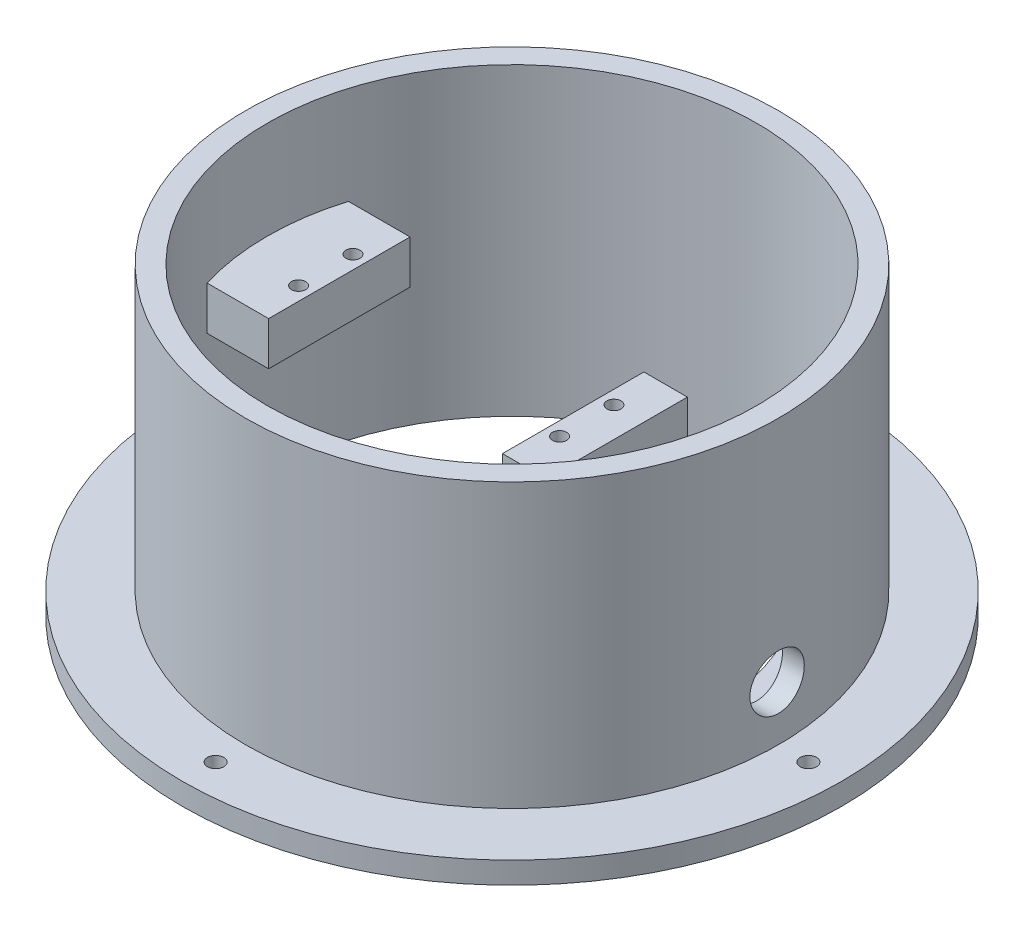
from build123d import *

# Parameters (mm, degrees)
SKETCH1_R           = 60.625
SKETCH1_R_2         = 45
BOSS_EXTRUDE1_DEPTH = 4
SKETCH2_R           = 49
SKETCH2_R_2         = 45
BOSS_EXTRUDE2_DEPTH = 52
SKETCH3_W           = 8
SKETCH3_H           = 38
SKETCH3_W_2         = 15
SKETCH3_H_2         = 8
BOSS_EXTRUDE3_DEPTH = 13
SKETCH4_R           = 1.3
CUT_EXTRUDE1_DEPTH  = 7.2
BOSS_EXTRUDE4_DEPTH = 4
SKETCH7_W           = 10
SKETCH7_H           = 24
CUT_EXTRUDE2_DEPTH  = 8
SKETCH8_R           = 5
CUT_EXTRUDE3_DEPTH  = 110.441337026
CUT_EXTRUDE4_REACH  = 104.405
SKETCH9_R           = 1.5


with BuildPart() as part:
    # Sketch1 → Boss-Extrude1 (new body)
    with BuildSketch(Plane(origin=(0, 0, 0), x_dir=(1, 0, 0), z_dir=(0, 1, 0))):
        with Locations(Location((0, 0, 0), (0, 0, 270))):
            Circle(SKETCH1_R)
        with Locations(Location((0, 0, 0), (0, 0, 270))):
            Circle(SKETCH1_R_2, mode=Mode.SUBTRACT)
    extrude(amount=BOSS_EXTRUDE1_DEPTH)

    # Sketch2 → Boss-Extrude2 (add)
    with BuildSketch(Plane(origin=(0, 4, 0), x_dir=(1, 0, 0), z_dir=(0, 1, 0))):
        with Locations(Location((0, 0, 0), (0, 0, 90))):
            Circle(SKETCH2_R)
        with Locations(Location((0, 0, 0), (0, 0, 270))):
            Circle(SKETCH2_R_2, mode=Mode.SUBTRACT)
    extrude(amount=BOSS_EXTRUDE2_DEPTH)

    # Sketch3 → Boss-Extrude3 (add, symmetric)
    with BuildSketch(Plane.XY):
        with Locations((15.25, 19)):
            Rectangle(SKETCH3_W, SKETCH3_H)
        with Locations((-39.25, 34)):
            Rectangle(SKETCH3_W_2, SKETCH3_H_2)
    extrude(amount=BOSS_EXTRUDE3_DEPTH, both=True)


with BuildPart() as boss_extrude3_piece_1:
    # of the separate pieces the step leaves, piece 1, a body of its own (boss_extrude3_pieces)
    add(part.part.solids().sort_by_distance((0, 0, 60.625))[0])


with BuildPart() as boss_extrude3_piece_2:
    # of the separate pieces the step leaves, piece 2, a body of its own (boss_extrude3_pieces)
    add(part.part.solids().sort_by_distance((11.25, 0, -13))[0])


with BuildPart() as cut_extrude1_tool:
    # Sketch4 → Cut-Extrude1 (new body)
    with BuildSketch(Plane(origin=(0, 38, 0), x_dir=(1, 0, 0), z_dir=(0, 1, 0))):
        with Locations(Location((13.75, 5, 0), (0, 0, 270))):
            Circle(SKETCH4_R)
        with Locations(Location((13.75, -5, 0), (0, 0, 270))):
            Circle(SKETCH4_R)
        with Locations(Location((-34.25, 5, 0), (0, 0, 270))):
            Circle(SKETCH4_R)
        with Locations(Location((-34.25, -5, 0), (0, 0, 270))):
            Circle(SKETCH4_R)
    extrude(amount=-CUT_EXTRUDE1_DEPTH)


with BuildPart() as boss_extrude3_piece_1_1:
    add(boss_extrude3_piece_1.part)

    # Cut-Extrude1: cut by cut_extrude1_tool
    add(cut_extrude1_tool.part, mode=Mode.SUBTRACT)



with BuildPart() as boss_extrude3_piece_2_1:
    add(boss_extrude3_piece_2.part)

    # Cut-Extrude1: cut by cut_extrude1_tool
    add(cut_extrude1_tool.part, mode=Mode.SUBTRACT)


with BuildPart() as boss_extrude3_piece_1_2:
    add(boss_extrude3_piece_1_1.part)

    add(boss_extrude3_piece_2_1.part)  # Boss-Extrude4 merges Boss-Extrude3 piece 2
    # Sketch5 → Boss-Extrude4 (add)
    with BuildSketch(Plane.XZ):
        with BuildLine():
            Line((11.25, 13), (25.249838503, 37.248431585))
            ThreePointArc((25.249838503, 37.248431585), (45, 0), (25.249838503, -37.248431585))
            Line((25.249838503, -37.248431585), (11.25, -13))
            Line((11.25, -13), (11.25, 13))
        make_face()
        with BuildLine():
            Line((24.25, -19.516660498), (27.361802413, -24.906460381))
            ThreePointArc((27.361802413, -24.906460381), (37, 0), (27.361802413, 24.906460381))
            Line((27.361802413, 24.906460381), (24.25, 19.516660498))
            Line((24.25, 19.516660498), (24.25, -19.516660498))
        make_face(mode=Mode.SUBTRACT)
    extrude(amount=-BOSS_EXTRUDE4_DEPTH)

    # Sketch7 → Cut-Extrude2 (cut)
    with BuildSketch(Plane.ZY.offset(-11.25)):
        with Locations((0, 17)):
            Rectangle(SKETCH7_W, SKETCH7_H)
    extrude(amount=-CUT_EXTRUDE2_DEPTH, mode=Mode.SUBTRACT)

    # Sketch8 → Cut-Extrude3 (cut, through all)
    with BuildSketch(Plane.ZY.offset(-11.25)):
        with Locations((0, 14)):
            Circle(SKETCH8_R)
    extrude(amount=-CUT_EXTRUDE3_DEPTH, mode=Mode.SUBTRACT)

    # Sketch9 → Cut-Extrude4 (cut, up to next)
    with BuildSketch(Plane.XZ, mode=Mode.PRIVATE) as cut_extrude4_sk1:
        with Locations(Location((54.5, 0, 0), (0, 0, 270))):
            Circle(SKETCH9_R)
    cut_extrude4_tool1 = extrude(cut_extrude4_sk1.sketch, amount=-CUT_EXTRUDE4_REACH, mode=Mode.PRIVATE) & boss_extrude3_piece_1_2.part
    # Sketch9 → Cut-Extrude4 (cut, up to next)
    with BuildSketch(Plane.XZ, mode=Mode.PRIVATE) as cut_extrude4_sk2:
        with Locations(Location((0, -54.5, 0), (0, 0, 270))):
            Circle(SKETCH9_R)
    cut_extrude4_tool2 = extrude(cut_extrude4_sk2.sketch, amount=-CUT_EXTRUDE4_REACH, mode=Mode.PRIVATE) & boss_extrude3_piece_1_2.part
    # Sketch9 → Cut-Extrude4 (cut, up to next)
    with BuildSketch(Plane.XZ, mode=Mode.PRIVATE) as cut_extrude4_sk3:
        with Locations(Location((-54.5, 0, 0), (0, 0, 270))):
            Circle(SKETCH9_R)
    cut_extrude4_tool3 = extrude(cut_extrude4_sk3.sketch, amount=-CUT_EXTRUDE4_REACH, mode=Mode.PRIVATE) & boss_extrude3_piece_1_2.part
    # Sketch9 → Cut-Extrude4 (cut, up to next)
    with BuildSketch(Plane.XZ, mode=Mode.PRIVATE) as cut_extrude4_sk4:
        with Locations(Location((0, 54.5, 0), (0, 0, 270))):
            Circle(SKETCH9_R)
    cut_extrude4_tool4 = extrude(cut_extrude4_sk4.sketch, amount=-CUT_EXTRUDE4_REACH, mode=Mode.PRIVATE) & boss_extrude3_piece_1_2.part
    add(cut_extrude4_tool1.solids().sort_by_distance((54.5, 0, 0))[0], mode=Mode.SUBTRACT)
    add(cut_extrude4_tool2.solids().sort_by_distance((0, 0, -54.5))[0], mode=Mode.SUBTRACT)
    add(cut_extrude4_tool3.solids().sort_by_distance((-54.5, 0, 0))[0], mode=Mode.SUBTRACT)
    add(cut_extrude4_tool4.solids().sort_by_distance((0, 0, 54.5))[0], mode=Mode.SUBTRACT)


solid = boss_extrude3_piece_1_2.part
